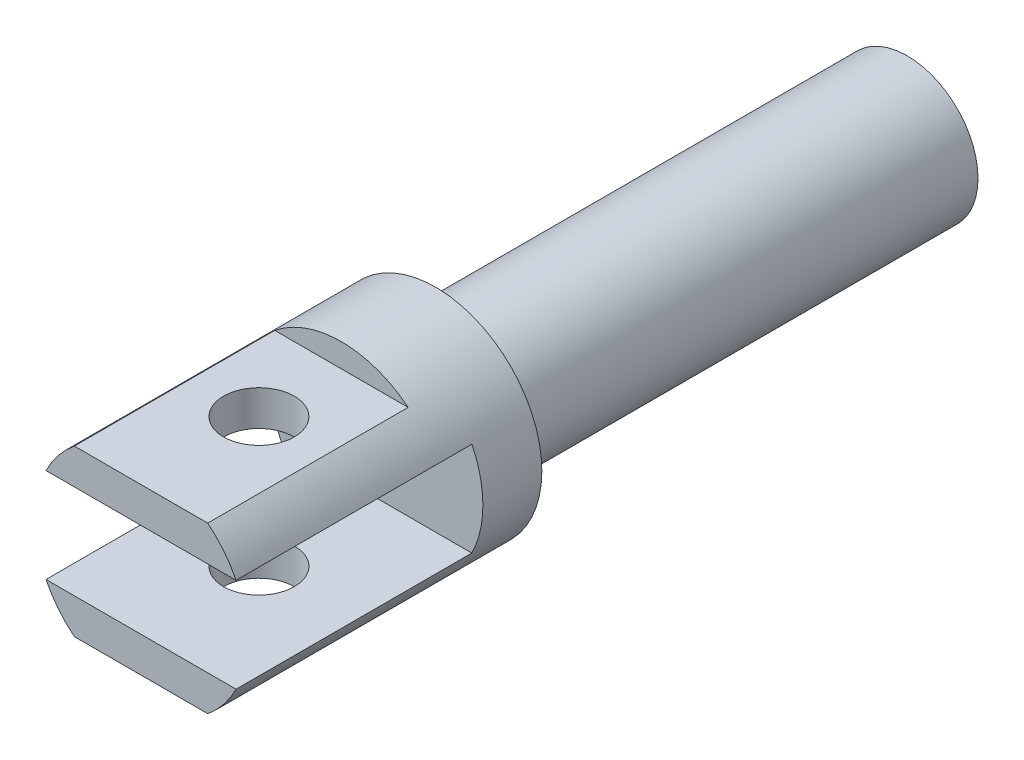
from build123d import *

# Parameters (mm, degrees)
SZKIC2_W                        = 18
SZKIC2_H                        = 8
WYTNIJ_WYCI_GNI_CIE1_DEPTH      = 20
WYTNIJ_WYCI_GNI_CIE2_DEPTH      = 42.976183724
WYTNIJ_WYCI_GNI_CIE2_DEPTH_BACK = 42.976183724
SZKIC3_R                        = 3
WYTNIJ_WYCI_GNI_CIE3_START      = 7
SZKIC3_4_W                      = 16.124515496
SZKIC3_4_H                      = 17
SZKIC3_4_R                      = 3
WYTNIJ_WYCI_GNI_CIE3_DEPTH      = 35.976183767


with BuildPart() as part:
    # Szkic1 → Obrót1 (revolve)
    with BuildSketch(Plane(origin=(0, 0, 0), x_dir=(1, 0, 0), z_dir=(0, 1, 0))):
        Polygon((0, -25), (9, -25), (9, 0), (6, 0), (6, 40), (0, 40), align=None)
    revolve(axis=Axis((0, 0, 44.409951059), (0, 0, -1)))

    # Szkic2 → Wytnij-wyciągnięcie1 (cut)
    with BuildSketch(Plane.XY.offset(25)):
        Rectangle(SZKIC2_W, SZKIC2_H)
    extrude(amount=-WYTNIJ_WYCI_GNI_CIE1_DEPTH, mode=Mode.SUBTRACT)

    # Szkic3 → Wytnij-wyciągnięcie2 (cut, two sides: drawn at the far end of the back side and taken through both)
    with BuildSketch(Plane(origin=(0, 0, 0), x_dir=(1, 0, 0), z_dir=(0, 1, 0)).offset(-WYTNIJ_WYCI_GNI_CIE2_DEPTH_BACK)):
        with Locations((0, -15)):
            Circle(SZKIC3_R)
    extrude(amount=WYTNIJ_WYCI_GNI_CIE2_DEPTH + WYTNIJ_WYCI_GNI_CIE2_DEPTH_BACK, mode=Mode.SUBTRACT)

    # Szkic3<4> → Wytnij-wyciągnięcie3 (cut, through all)
    with BuildSketch(Plane(origin=(0, 0, 0), x_dir=(1, 0, 0), z_dir=(0, 1, 0)).offset(WYTNIJ_WYCI_GNI_CIE3_START)):
        with Locations((0, -16.5)):
            Rectangle(SZKIC3_4_W, SZKIC3_4_H)
        with Locations((0, -15)):
            Circle(SZKIC3_4_R, mode=Mode.SUBTRACT)
    wytnij_wyci_gni_cie3 = extrude(amount=WYTNIJ_WYCI_GNI_CIE3_DEPTH, mode=Mode.SUBTRACT)

    # Lustro1: Wytnij-wyciągnięcie3 across plane
    add(wytnij_wyci_gni_cie3.mirror(Plane.ZX), mode=Mode.SUBTRACT)


solid = part.part
